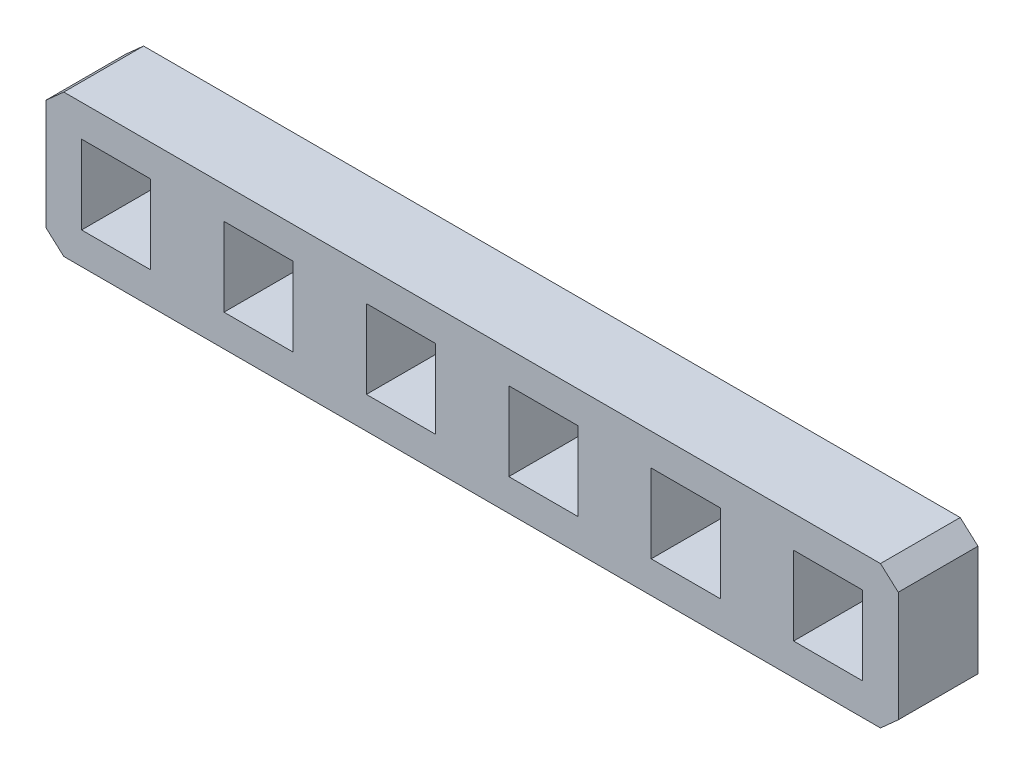
from build123d import *

# Parameters (mm, degrees)
SCHIZZO1_W                   = 4.85
SCHIZZO1_H                   = 5.525
ESTRUSIONE_ESTRUSIONE2_DEPTH = 5.6


with BuildPart() as part:
    # Schizzo1 → Estrusione-Estrusione2 (new body)
    with BuildSketch(Plane.XY):
        Polygon((-30.55, 3.88125), (-30.55, -3.88125), (-29.3, -5), (28.05, -5), (29.3, -3.88125), (29.3, 3.88125), (28.05, 5), (-29.3, 5), align=None)
        with Locations((-15.625, 0)):
            Rectangle(SCHIZZO1_W, SCHIZZO1_H, mode=Mode.SUBTRACT)
        with Locations((-25.625, 0)):
            Rectangle(SCHIZZO1_W, SCHIZZO1_H, mode=Mode.SUBTRACT)
        with Locations((-5.625, 0)):
            Rectangle(SCHIZZO1_W, SCHIZZO1_H, mode=Mode.SUBTRACT)
        with Locations((4.375, 0)):
            Rectangle(SCHIZZO1_W, SCHIZZO1_H, mode=Mode.SUBTRACT)
        with Locations((14.375, 0)):
            Rectangle(SCHIZZO1_W, SCHIZZO1_H, mode=Mode.SUBTRACT)
        with Locations((24.375, 0)):
            Rectangle(SCHIZZO1_W, SCHIZZO1_H, mode=Mode.SUBTRACT)
    extrude(amount=ESTRUSIONE_ESTRUSIONE2_DEPTH)


solid = part.part
